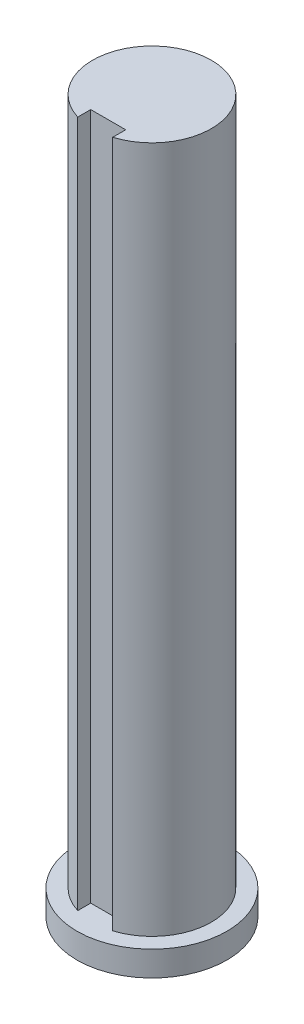
from build123d import *

# Parameters (mm, degrees)
SKETCH1_R           = 7.62
BOSS_EXTRUDE1_DEPTH = 2.54
BOSS_EXTRUDE2_DEPTH = 69.85


with BuildPart() as part:
    # Sketch1 → Boss-Extrude1 (new body)
    with BuildSketch(Plane(origin=(0, 0, 0), x_dir=(1, 0, 0), z_dir=(0, 1, 0))):
        with Locations(Location((0, 0, 0), (0, 0, 270))):
            Circle(SKETCH1_R)
    extrude(amount=BOSS_EXTRUDE1_DEPTH)

    # Sketch2 → Boss-Extrude2 (add)
    with BuildSketch(Plane(origin=(0, 2.54, 0), x_dir=(-1, 0, 0), z_dir=(0, 1, 0))):
        with BuildLine():
            Line((1.778, 4.445), (-1.778, 4.445))
            Line((-1.778, 4.445), (-1.778, 5.764527062))
            ThreePointArc((-1.778, 5.764527062), (-3.582266828, -4.853701745), (6.0325, 0))
            ThreePointArc((6.0325, 0), (4.853701745, 3.582266828), (1.778, 5.764527062))
            Line((1.778, 5.764527062), (1.778, 4.445))
        make_face()
    extrude(amount=BOSS_EXTRUDE2_DEPTH)


solid = part.part
